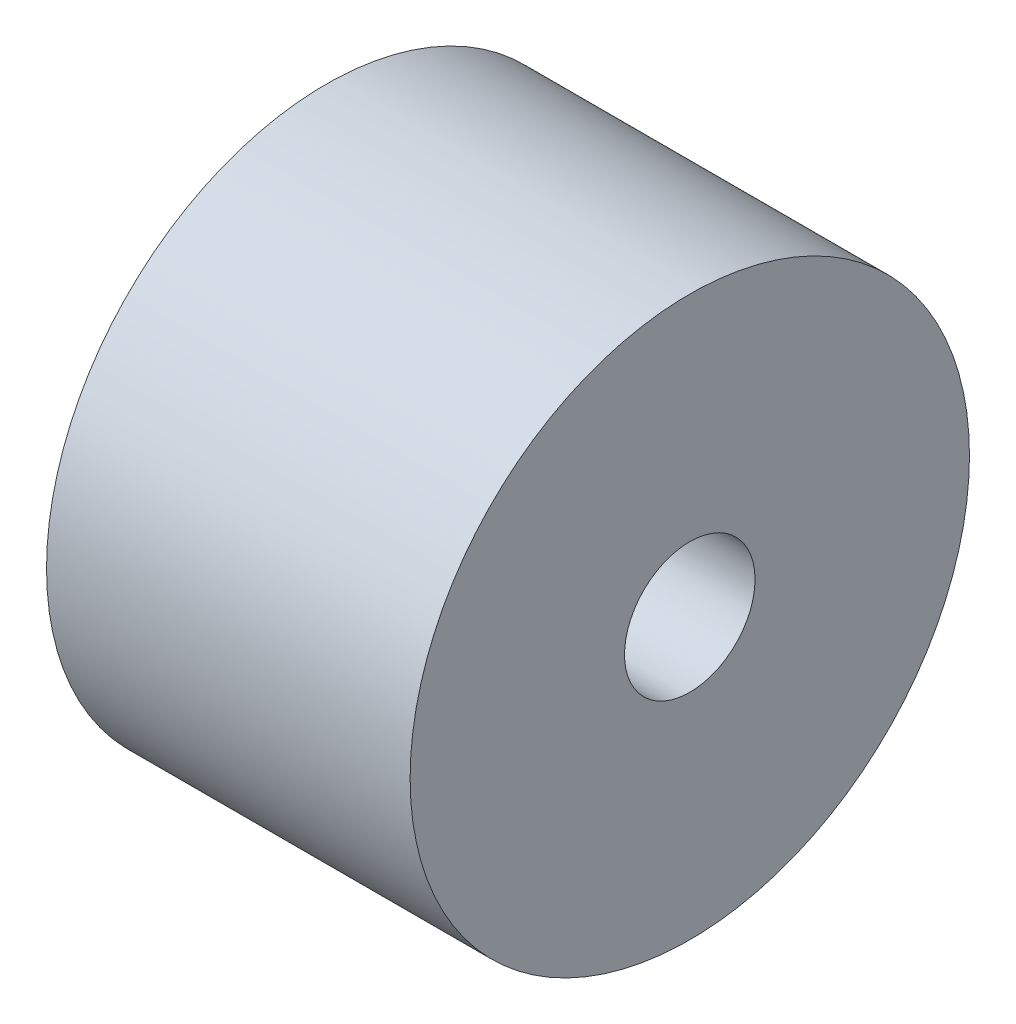
from build123d import *

# Parameters (mm, degrees)
SKETCH1_R           = 9
SKETCH1_R_2         = 2.1
BOSS_EXTRUDE1_DEPTH = 11.7


with BuildPart() as part:
    # Sketch1 → Boss-Extrude1 (new body)
    with BuildSketch(Plane(origin=(0, 0, 0), x_dir=(0, 0, -1), z_dir=(1, 0, 0))):
        Circle(SKETCH1_R)
        Circle(SKETCH1_R_2, mode=Mode.SUBTRACT)
    extrude(amount=BOSS_EXTRUDE1_DEPTH)


solid = part.part
